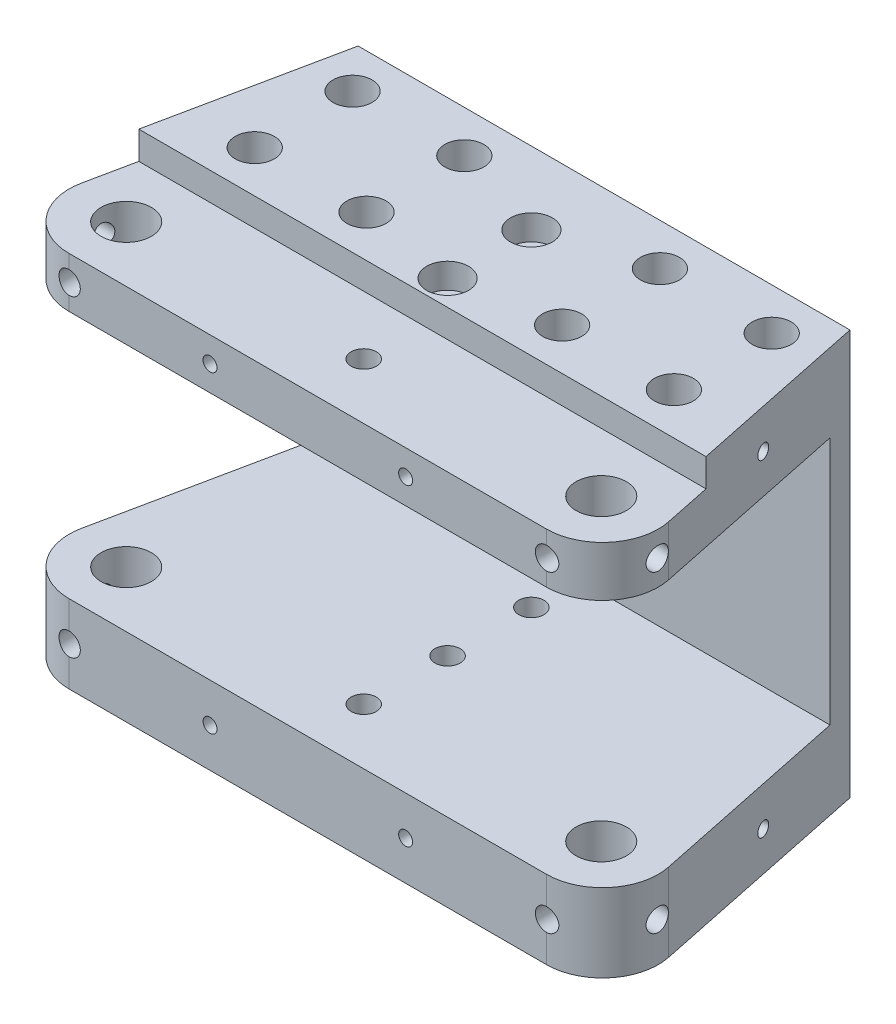
from build123d import *

# Parameters (mm, degrees)
SKETCH_1_W             = 220
SKETCH_1_H             = 145
EXTRUDE_1_DEPTH        = 9
SKETCH_9_R             = 22.5
CUT_EXTRUDE_4_DEPTH    = 430
SKETCH_11_W            = 220
SKETCH_11_H            = 28
EXTRUDE_3_DEPTH        = 97
SKETCH_12_R            = 9
CUT_EXTRUDE_6_DEPTH    = 285.00880268
SKETCH_13_R            = 6
CUT_EXTRUDE_9_DEPTH    = 20
SKETCH_15_W            = 220
SKETCH_15_H            = 41
CUT_EXTRUDE_10_DEPTH   = 10
CUT_EXTRUDE_11_DEPTH   = 285.00880268
FILLET_1_R             = 20
SKETCH_18_R            = 4
CUT_EXTRUDE_13_DEPTH   = 20
SKETCH_22_R            = 7
CUT_EXTRUDE_26_DEPTH   = 25
CUT_EXTRUDE_START      = -25
SKETCH_23_R            = 7
CUT_EXTRUDE_27_DEPTH   = 25
SKETCH_26_R            = 4.5
CUT_EXTRUDE_29_DEPTH   = 281.478163127
SKETCH_27_R            = 7.5
CUT_EXTRUDE_30_DEPTH   = 9
CUT_EXTRUDE_START_2    = -9
SKETCH_28_R            = 7.5
CUT_EXTRUDE_31_DEPTH   = 9
SKETCH_29_R            = 4
CUT_EXTRUDE_32_DEPTH   = 29
PATTERN_LINEAR_1_COUNT = 2
PATTERN_LINEAR_1_PITCH = 200
SKETCH_30_R            = 2.5
CUT_EXTRUDE_33_DEPTH   = 10
SKETCH_31_R            = 2.5
CUT_EXTRUDE_34_DEPTH   = 10
SKETCH_32_R            = 2.5
CUT_EXTRUDE_35_DEPTH   = 10


with BuildPart() as part:
    # 草图1 → 拉伸1 (new body)
    with BuildSketch(Plane.XY):
        with Locations((110, -72.5)):
            Rectangle(SKETCH_1_W, SKETCH_1_H)
    extrude(amount=EXTRUDE_1_DEPTH)

    # 草图9 → 切除-拉伸4 (cut)
    with BuildSketch(Plane(origin=(0, 0, 0), x_dir=(-1, 0, 0), z_dir=(0, 0, -1))):
        with Locations((-110, -72.5)):
            Circle(SKETCH_9_R)
    extrude(amount=-CUT_EXTRUDE_4_DEPTH, mode=Mode.SUBTRACT)

    # 草图11 → 拉伸3 (add)
    with BuildSketch(Plane.XY.offset(9)):
        with Locations((110, -131)):
            Rectangle(SKETCH_11_W, SKETCH_11_H)
        with Locations((110, -14)):
            Rectangle(SKETCH_11_W, SKETCH_11_H)
    extrude(amount=EXTRUDE_3_DEPTH)

    # 草图12 → 切除-拉伸6 (cut, through all)
    with BuildSketch(Plane.XZ.offset(145)):
        with Locations(Location((25, 86, 0), (0, 0, 270))):
            Circle(SKETCH_12_R)
        with Locations(Location((195, 86, 0), (0, 0, 90))):
            Circle(SKETCH_12_R)
    extrude(amount=-CUT_EXTRUDE_6_DEPTH, mode=Mode.SUBTRACT)

    # 草图13 → 切除-拉伸9 (cut)
    with BuildSketch(Plane(origin=(0, 0, 0), x_dir=(-1, 0, 0), z_dir=(0, 0, -1))):
        with Locations((-167, -129.5)):
            Circle(SKETCH_13_R)
        with Locations((-53, -129.5)):
            Circle(SKETCH_13_R)
        with Locations((-167, -15.5)):
            Circle(SKETCH_13_R)
        with Locations((-53, -15.5)):
            Circle(SKETCH_13_R)
    extrude(amount=-CUT_EXTRUDE_9_DEPTH, mode=Mode.SUBTRACT)

    # 草图15 → 切除-拉伸10 (cut)
    with BuildSketch(Plane(origin=(0, 0, 0), x_dir=(1, 0, 0), z_dir=(0, 1, 0))):
        with Locations((110, -85.5)):
            Rectangle(SKETCH_15_W, SKETCH_15_H)
    extrude(amount=-CUT_EXTRUDE_10_DEPTH, mode=Mode.SUBTRACT)

    # 草图16 → 切除-拉伸11 (cut, through all)
    with BuildSketch(Plane.XZ.offset(145)):
        Polygon((22, 0), (0, 106), (0, 0), align=None)
        Polygon((220, 106), (198, 0), (220, 0), align=None)
    extrude(amount=-CUT_EXTRUDE_11_DEPTH, mode=Mode.SUBTRACT)

    # 圆角1
    fillet_1_edges = [part.edges().sort_by_distance(p)[0] for p in [
        (0, -131, 106),
        (220, -131, 106),
        (220, -19, 106),
        (0, -19, 106),
    ]]
    fillet(fillet_1_edges, radius=FILLET_1_R)

    # 草图18 → 切除-拉伸13 (cut)
    with BuildSketch(Plane.XY.offset(106)):
        with Locations((24.577160155, -131)):
            Circle(SKETCH_18_R)
        with Locations((24.577160155, -19)):
            Circle(SKETCH_18_R)
        with Locations((195.422839845, -131)):
            Circle(SKETCH_18_R)
        with Locations((195.422839845, -19)):
            Circle(SKETCH_18_R)
    extrude(amount=-CUT_EXTRUDE_13_DEPTH, mode=Mode.SUBTRACT)

    # 草图22 → 切除-拉伸26 (cut)
    with BuildSketch(Plane(origin=(0, 0, 0), x_dir=(1, 0, 0), z_dir=(0, 1, 0))):
        with Locations(Location((145, -50, 0), (0, 0, 270))):
            Circle(SKETCH_22_R)
        with Locations(Location((75, -15, 0), (0, 0, 90))):
            Circle(SKETCH_22_R)
        with Locations(Location((35, -50, 0), (0, 0, 90))):
            Circle(SKETCH_22_R)
        with Locations(Location((35, -15, 0), (0, 0, 90))):
            Circle(SKETCH_22_R)
        with Locations(Location((185, -15, 0), (0, 0, 270))):
            Circle(SKETCH_22_R)
        with Locations(Location((185, -50, 0), (0, 0, 270))):
            Circle(SKETCH_22_R)
        with Locations(Location((145, -15, 0), (0, 0, 270))):
            Circle(SKETCH_22_R)
        with Locations(Location((75, -50, 0), (0, 0, 90))):
            Circle(SKETCH_22_R)
    extrude(amount=-CUT_EXTRUDE_26_DEPTH, mode=Mode.SUBTRACT)

    # 草图23 → 切除-拉伸27 (cut)
    with BuildSketch(Plane.XZ.offset(145).offset(CUT_EXTRUDE_START)):
        with Locations(Location((35, 50, 0), (0, 0, 270))):
            Circle(SKETCH_23_R)
        with Locations(Location((75, 50, 0), (0, 0, 270))):
            Circle(SKETCH_23_R)
        with Locations(Location((75, 15, 0), (0, 0, 270))):
            Circle(SKETCH_23_R)
        with Locations(Location((35, 15, 0), (0, 0, 270))):
            Circle(SKETCH_23_R)
        with Locations(Location((145, 15, 0), (0, 0, 90))):
            Circle(SKETCH_23_R)
        with Locations(Location((145, 50, 0), (0, 0, 90))):
            Circle(SKETCH_23_R)
        with Locations(Location((185, 50, 0), (0, 0, 90))):
            Circle(SKETCH_23_R)
        with Locations(Location((185, 15, 0), (0, 0, 90))):
            Circle(SKETCH_23_R)
    extrude(amount=CUT_EXTRUDE_27_DEPTH, mode=Mode.SUBTRACT)

    # 草图26 → 切除-拉伸29 (cut, through all)
    with BuildSketch(Plane.XZ.offset(145)):
        with Locations(Location((110, 86, 0), (0, 0, 90))):
            Circle(SKETCH_26_R)
        with Locations(Location((110, 56, 0), (0, 0, 270))):
            Circle(SKETCH_26_R)
        with Locations(Location((110, 26, 0), (0, 0, 270))):
            Circle(SKETCH_26_R)
    extrude(amount=-CUT_EXTRUDE_29_DEPTH, mode=Mode.SUBTRACT)

    # 草图27 → 切除-拉伸30 (cut)
    with BuildSketch(Plane(origin=(0, 0, 0), x_dir=(1, 0, 0), z_dir=(0, 1, 0))):
        with Locations(Location((110, -26, 0), (0, 0, 270))):
            Circle(SKETCH_27_R)
        with Locations(Location((110, -56, 0), (0, 0, 270))):
            Circle(SKETCH_27_R)
    extrude(amount=-CUT_EXTRUDE_30_DEPTH, mode=Mode.SUBTRACT)

    # 草图28 → 切除-拉伸31 (cut)
    with BuildSketch(Plane.XZ.offset(145).offset(CUT_EXTRUDE_START_2)):
        with Locations(Location((110, 86, 0), (0, 0, 270))):
            Circle(SKETCH_28_R)
        with Locations(Location((110, 56, 0), (0, 0, 90))):
            Circle(SKETCH_28_R)
        with Locations(Location((110, 26, 0), (0, 0, 90))):
            Circle(SKETCH_28_R)
    extrude(amount=CUT_EXTRUDE_31_DEPTH, mode=Mode.SUBTRACT)

    # 草图29 → 切除-拉伸32 (cut)
    with BuildSketch(Plane(origin=(0, 0, 0), x_dir=(0, 0, -1), z_dir=(1, 0, 0))):
        with Locations(Location((-86, -19, 0), (0, 0, 180))):
            Circle(SKETCH_29_R)
        with Locations(Location((-86, -131, 0), (0, 0, 180))):
            Circle(SKETCH_29_R)
    cut_extrude_32 = extrude(amount=CUT_EXTRUDE_32_DEPTH, mode=Mode.SUBTRACT)

    # 阵列(线性)1: 切除-拉伸32 ×2
    with Locations(*[(i * PATTERN_LINEAR_1_PITCH, 0, 0) for i in range(1, PATTERN_LINEAR_1_COUNT)]):
        add(cut_extrude_32, mode=Mode.SUBTRACT)

    # 草图30 → 切除-拉伸33 (cut)
    with BuildSketch(Plane.XY.offset(106)):
        with Locations((75.000000005, -19)):
            Circle(SKETCH_30_R)
        with Locations((145.000000005, -19)):
            Circle(SKETCH_30_R)
        with Locations((75.000000005, -131)):
            Circle(SKETCH_30_R)
        with Locations((145.000000005, -131)):
            Circle(SKETCH_30_R)
    extrude(amount=-CUT_EXTRUDE_33_DEPTH, mode=Mode.SUBTRACT)

    # 草图31 → 切除-拉伸34 (cut)
    with BuildSketch(Plane(origin=(21.091467577, 0, 4.377474403), x_dir=(-0.20321645683272063, 0, 0.9791338374667455), z_dir=(-0.9791338374667455, 0, -0.20321645683272063))):
        with Locations((35.52923795, -131)):
            Circle(SKETCH_31_R)
        with Locations((35.52923795, -14)):
            Circle(SKETCH_31_R)
    extrude(amount=-CUT_EXTRUDE_34_DEPTH, mode=Mode.SUBTRACT)

    # 草图32 → 切除-拉伸35 (cut)
    with BuildSketch(Plane(origin=(189.823208191, 0, -39.397269625), x_dir=(-0.20321645683272074, 0, -0.9791338374667454), z_dir=(0.9791338374667454, 0, -0.20321645683272074))):
        with Locations((-80.236858453, -131)):
            Circle(SKETCH_32_R)
        with Locations((-80.236858453, -14)):
            Circle(SKETCH_32_R)
    extrude(amount=-CUT_EXTRUDE_35_DEPTH, mode=Mode.SUBTRACT)


solid = part.part
